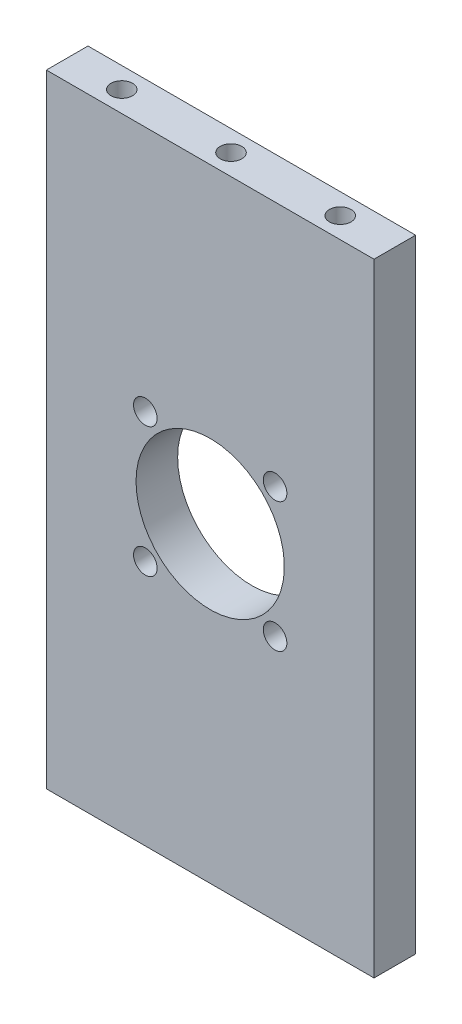
from build123d import *

# Parameters (mm, degrees)
SKETCH1_W                 = 50
SKETCH1_H                 = 95
BOSS_EXTRUDE1_DEPTH       = 6.35
M4X0_7_TAPPED_HOLE1_D     = 3.3
M4X0_7_TAPPED_HOLE1_DEPTH = 10
M4X0_7_TAPPED_HOLE1_TIP   = 0.991420021
M4X0_7_TAPPED_HOLE2_D     = 3.3
M4X0_7_TAPPED_HOLE2_DEPTH = 10
M4X0_7_TAPPED_HOLE2_TIP   = 0.991420021
SKETCH7_R                 = 11.3175
CUT_EXTRUDE1_DEPTH        = 55.051572595
M3_CLEARANCE_HOLE1_D      = 3.6


with BuildPart() as part:
    # Sketch1 → Boss-Extrude1 (new body)
    with BuildSketch(Plane.XY):
        Rectangle(SKETCH1_W, SKETCH1_H)
    extrude(amount=-BOSS_EXTRUDE1_DEPTH)

    # M4x0.7 Tapped Hole1
    with Locations(Plane.XZ.offset(47.5)):
        with Locations((-16.67, -3.175), (16.67, -3.175), (0, -3.175)):
            Hole(M4X0_7_TAPPED_HOLE1_D / 2, depth=M4X0_7_TAPPED_HOLE1_DEPTH)
            with Locations((0, 0, -(M4X0_7_TAPPED_HOLE1_DEPTH + M4X0_7_TAPPED_HOLE1_TIP / 2))):  # 118° drill point
                Cone(0, M4X0_7_TAPPED_HOLE1_D / 2, M4X0_7_TAPPED_HOLE1_TIP, mode=Mode.SUBTRACT)

    # M4x0.7 Tapped Hole2
    with Locations(Plane(origin=(0, 47.5, 0), x_dir=(1, 0, 0), z_dir=(0, 1, 0))):
        with Locations((-16.67, 3.175), (0, 3.175), (16.67, 3.175)):
            Hole(M4X0_7_TAPPED_HOLE2_D / 2, depth=M4X0_7_TAPPED_HOLE2_DEPTH)
            with Locations((0, 0, -(M4X0_7_TAPPED_HOLE2_DEPTH + M4X0_7_TAPPED_HOLE2_TIP / 2))):  # 118° drill point
                Cone(0, M4X0_7_TAPPED_HOLE2_D / 2, M4X0_7_TAPPED_HOLE2_TIP, mode=Mode.SUBTRACT)

    # Sketch7 → Cut-Extrude1 (cut, through all)
    with BuildSketch(Plane(origin=(0, 0, -6.35), x_dir=(-1, 0, 0), z_dir=(0, 0, -1))):
        Circle(SKETCH7_R)
    extrude(amount=-CUT_EXTRUDE1_DEPTH, mode=Mode.SUBTRACT)

    # M3 Clearance Hole1 (through all)
    with Locations(Plane(origin=(0, 0, -6.35), x_dir=(-1, 0, 0), z_dir=(0, 0, -1))):
        with Locations((-9.899494937, 9.899494937), (9.899494937, 9.899494937), (9.899494937, -9.899494937), (-9.899494937, -9.899494937), (0, 0)):
            Hole(M3_CLEARANCE_HOLE1_D / 2)


solid = part.part
